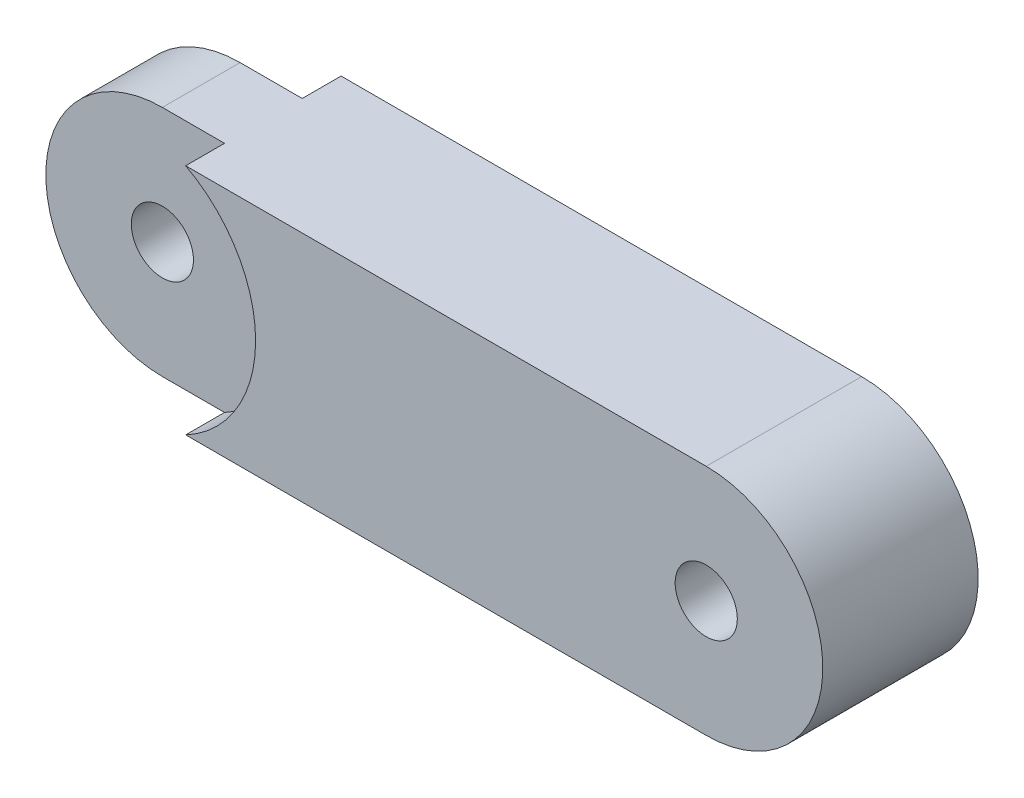
from build123d import *

# Parameters (mm, degrees)
SKETCH_1_R          = 4
EXTRUDE_1_DEPTH     = 20
SKETCH_2_R          = 17
CUT_EXTRUDE_1_DEPTH = 5
CUT_EXTRUDE_START   = 15
SKETCH_2_2_R        = 17
CUT_EXTRUDE_2_DEPTH = 5


with BuildPart() as part:
    # 草图1 → 凸台-拉伸1 (new body)
    with BuildSketch(Plane.XY):
        with BuildLine():
            Line((0, 15), (75, 15))
            ThreePointArc((75, 15), (90, 0), (75, -15))
            Line((75, -15), (0, -15))
            ThreePointArc((0, -15), (-15, 0), (0, 15))
        make_face()
        Circle(SKETCH_1_R, mode=Mode.SUBTRACT)
        with Locations((75, 0)):
            Circle(SKETCH_1_R, mode=Mode.SUBTRACT)
    extrude(amount=EXTRUDE_1_DEPTH)

    # 草图2 → 切除-拉伸1 (cut)
    with BuildSketch(Plane.XY):
        Circle(SKETCH_2_R)
    extrude(amount=CUT_EXTRUDE_1_DEPTH, mode=Mode.SUBTRACT)

    # 草图2<2> → 切除-拉伸2 (cut)
    with BuildSketch(Plane.XY.offset(CUT_EXTRUDE_START)):
        Circle(SKETCH_2_2_R)
    extrude(amount=CUT_EXTRUDE_2_DEPTH, mode=Mode.SUBTRACT)


solid = part.part
